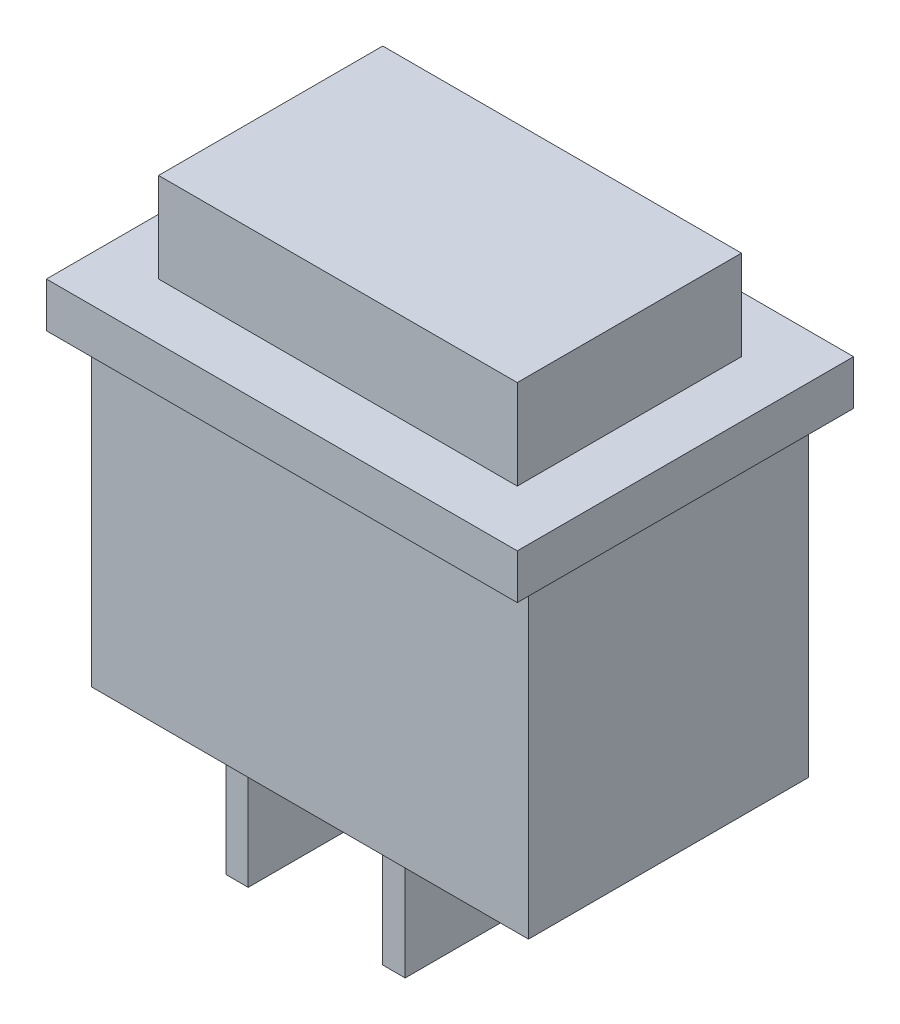
from build123d import *

# Parameters (mm, degrees)
SKETCH_1_W      = 21
SKETCH_1_H      = 15
EXTRUDE_1_DEPTH = 2
SKETCH_2_W      = 16
SKETCH_2_H      = 10
EXTRUDE_2_DEPTH = 4
SKETCH_3_W      = 19.5
SKETCH_3_H      = 12.5
EXTRUDE_3_DEPTH = 14
SKETCH_4_W      = 1
SKETCH_4_H      = 5
EXTRUDE_4_DEPTH = 8


with BuildPart() as part:
    # Эскиз1 → Бобышка-Вытянуть1 (new body)
    with BuildSketch(Plane(origin=(0, 0, 0), x_dir=(1, 0, 0), z_dir=(0, 1, 0))):
        Rectangle(SKETCH_1_W, SKETCH_1_H)
    extrude(amount=EXTRUDE_1_DEPTH)

    # Эскиз2 → Бобышка-Вытянуть2 (add)
    with BuildSketch(Plane(origin=(0, 2, 0), x_dir=(1, 0, 0), z_dir=(0, 1, 0))):
        Rectangle(SKETCH_2_W, SKETCH_2_H)
    extrude(amount=EXTRUDE_2_DEPTH)

    # Эскиз3 → Бобышка-Вытянуть3 (add)
    with BuildSketch(Plane.XZ):
        Rectangle(SKETCH_3_W, SKETCH_3_H)
    extrude(amount=EXTRUDE_3_DEPTH)

    # Эскиз4 → Бобышка-Вытянуть4 (add)
    with BuildSketch(Plane.XZ.offset(14)):
        with Locations((-7, 0)):
            Rectangle(SKETCH_4_W, SKETCH_4_H)
        Rectangle(SKETCH_4_W, SKETCH_4_H)
    extrude(amount=EXTRUDE_4_DEPTH)


solid = part.part
